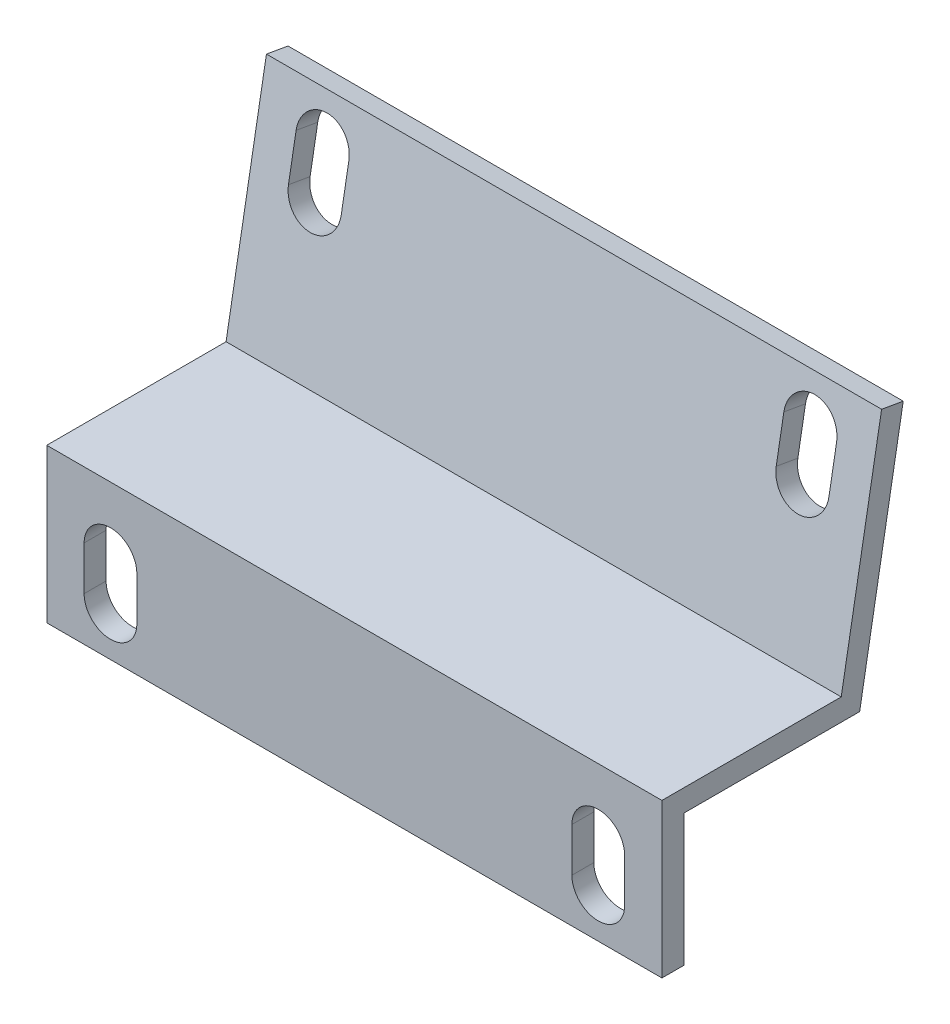
from build123d import *

# Parameters (mm, degrees)
EXTRUDE_1_DEPTH     = 70
CUT_EXTRUDE_1_DEPTH = 70
CUT_EXTRUDE_2_DEPTH = 10


with BuildPart() as part:
    # 草图1 → 凸台-拉伸1 (new body)
    with BuildSketch(Plane(origin=(0, 0, 0), x_dir=(0, 0, -1), z_dir=(1, 0, 0))):
        Polygon((0, 0), (20, 0), (24.957460038, 28.115152986), (22.495440656, 28.54927343), (17.902250922, 2.5), (-2.5, 2.5), (-2.5, -15), (0, -15), align=None)
    extrude(amount=EXTRUDE_1_DEPTH)

    # 草图2 → 切除-拉伸1 (cut)
    with BuildSketch(Plane.XY.offset(2.5)):
        with BuildLine():
            Line((4.25, -10), (4.25, -5))
            ThreePointArc((4.25, -5), (7.25, -2), (10.25, -5))
            Line((10.25, -5), (10.25, -10))
            ThreePointArc((10.25, -10), (7.25, -13), (4.25, -10))
        make_face()
        with BuildLine():
            Line((65.75, -10), (65.75, -5))
            ThreePointArc((65.75, -5), (62.75, -2), (59.75, -5))
            Line((59.75, -5), (59.75, -10))
            ThreePointArc((59.75, -10), (62.75, -13), (65.75, -10))
        make_face()
    extrude(amount=-CUT_EXTRUDE_1_DEPTH, mode=Mode.SUBTRACT)

    # 草图3 → 切除-拉伸2 (cut)
    with BuildSketch(Plane(origin=(0, -2.986080989, -16.934906825), x_dir=(1, 0, 0), z_dir=(0, 0.17364817766693397, 0.9848077530122076))):
        with BuildLine():
            Line((4.25, 26.994852841), (4.25, 21.994852841))
            ThreePointArc((4.25, 21.994852841), (7.25, 18.994852841), (10.25, 21.994852841))
            Line((10.25, 21.994852841), (10.25, 26.994852841))
            ThreePointArc((10.25, 26.994852841), (7.25, 29.994852841), (4.25, 26.994852841))
        make_face()
        with BuildLine():
            Line((59.75, 26.994852841), (59.75, 21.994852841))
            ThreePointArc((59.75, 21.994852841), (62.75, 18.994852841), (65.75, 21.994852841))
            Line((65.75, 21.994852841), (65.75, 26.994852841))
            ThreePointArc((65.75, 26.994852841), (62.75, 29.994852841), (59.75, 26.994852841))
        make_face()
    extrude(amount=-CUT_EXTRUDE_2_DEPTH, mode=Mode.SUBTRACT)


solid = part.part
